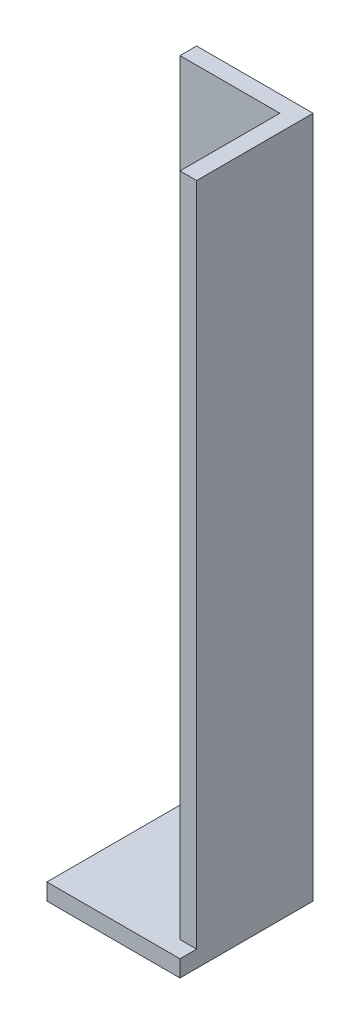
from build123d import *

# Parameters (mm, degrees)
SKETCH_1_W           = 100
SKETCH_1_H           = 100
EXTRUDE_1_DEPTH      = 10
EXTRUDE_2_DEPTH      = 400
SKETCH_3_OUTSIDE_W   = 188.74
SKETCH_3_OUTSIDE_H   = 188.74
SKETCH_3_OUTSIDE_W_2 = 80
SKETCH_3_OUTSIDE_H_2 = 80
CUT_EXTRUDE_1_DEPTH  = 400


with BuildPart() as part:
    # 草图1 → 凸台-拉伸1 (new body)
    with BuildSketch(Plane(origin=(0, 0, 0), x_dir=(1, 0, 0), z_dir=(0, 1, 0))):
        with Locations((11.323542268, -6.987712791)):
            Rectangle(SKETCH_1_W, SKETCH_1_H)
    extrude(amount=EXTRUDE_1_DEPTH)

    # 草图2 → 凸台-拉伸2 (add)
    with BuildSketch(Plane(origin=(0, 10, 0), x_dir=(1, 0, 0), z_dir=(0, 1, 0))):
        Polygon((51.323542268, 33.012287209), (-18.676457732, 33.012287209), (-18.676457732, 23.012287209), (41.323542268, 23.012287209), (41.323542268, -36.987712791), (51.323542268, -36.987712791), align=None)
    extrude(amount=EXTRUDE_2_DEPTH)

    # 草图3 outside → 切除-拉伸1 (cut)
    with BuildSketch(Plane(origin=(0, 10, 0), x_dir=(1, 0, 0), z_dir=(0, 1, 0))):
        with Locations((11.324, -6.988)):
            Rectangle(SKETCH_3_OUTSIDE_W, SKETCH_3_OUTSIDE_H)
        with Locations((11.323542268, -6.987712791)):
            Rectangle(SKETCH_3_OUTSIDE_W_2, SKETCH_3_OUTSIDE_H_2, mode=Mode.SUBTRACT)
    extrude(amount=-CUT_EXTRUDE_1_DEPTH, mode=Mode.SUBTRACT)


solid = part.part
